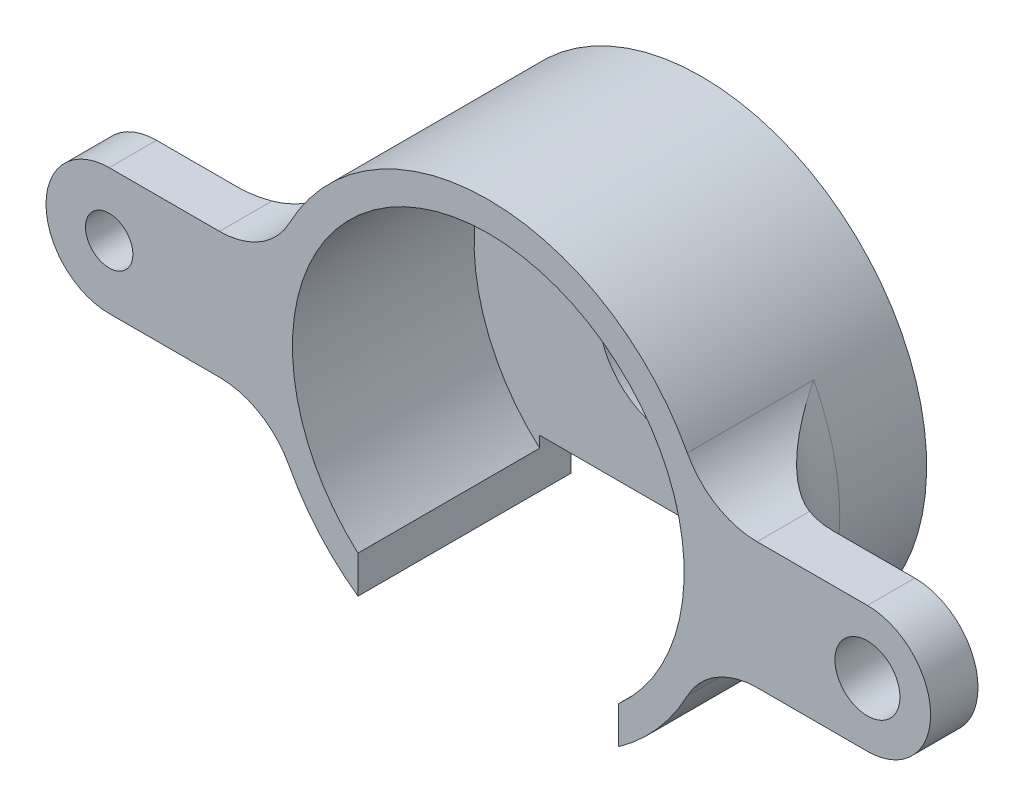
from build123d import *

# Parameters (mm, degrees)
SKETCH_1_R          = 14.25
SKETCH_1_R_2        = 12.4
EXTRUDE_1_DEPTH     = 11.5
EXTRUDE_START       = 2
SKETCH_2_R          = 14.25
SKETCH_2_R_2        = 4.5
SKETCH_2_R_3        = 1.5
EXTRUDE_2_DEPTH     = 2
SKETCH_4_W          = 16.5
SKETCH_4_H          = 7.711801842
CUT_EXTRUDE_2_DEPTH = 19
EXTRUDE_START_2     = -3
SKETCH_5_R          = 1.5
SKETCH_5_R_2        = 2.058377943
EXTRUDE_3_DEPTH     = 3
FILLET_1_R          = 5


with BuildPart() as part:
    # 草图1 → 凸台-拉伸1 (new body)
    with BuildSketch(Plane.XY):
        Circle(SKETCH_1_R)
        Circle(SKETCH_1_R_2, mode=Mode.SUBTRACT)
    extrude(amount=EXTRUDE_1_DEPTH)

    # 草图2 → 凸台-拉伸2 (add)
    with BuildSketch(Plane(origin=(0, 0, 0), x_dir=(-1, 0, 0), z_dir=(0, 0, -1)).offset(EXTRUDE_START)):
        Circle(SKETCH_2_R)
        Circle(SKETCH_2_R_2, mode=Mode.SUBTRACT)
        with Locations((-10, 0)):
            Circle(SKETCH_2_R_3, mode=Mode.SUBTRACT)
    extrude(amount=-EXTRUDE_2_DEPTH)

    # 草图4 → 切除-拉伸2 (cut)
    with BuildSketch(Plane.XY.offset(11.5)):
        with Locations((0, -12.4)):
            Rectangle(SKETCH_4_W, SKETCH_4_H)
    extrude(amount=-CUT_EXTRUDE_2_DEPTH, mode=Mode.SUBTRACT)

    # 草图5 → 凸台-拉伸3 (add)
    # profile 1 of 2: a face of its own
    with BuildSketch(Plane.XY.offset(11.5).offset(EXTRUDE_START_2)):
        with BuildLine():
            Line((-24, 4), (-13.677079367, 4))
            ThreePointArc((-13.677079367, 4), (-14.25, 0), (-13.677079367, -4))
            Line((-13.677079367, -4), (-24, -4))
            ThreePointArc((-24, -4), (-28, 0), (-24, 4))
        make_face()
        with Locations((-24, 0)):
            Circle(SKETCH_5_R, mode=Mode.SUBTRACT)
    # profile 2 of 2: a face of its own
    with BuildSketch(Plane.XY.offset(11.5).offset(EXTRUDE_START_2)):
        with BuildLine():
            Line((13.677079367, 4), (24, 4))
            ThreePointArc((24, 4), (28, 0), (24, -4))
            Line((24, -4), (13.677079367, -4))
            ThreePointArc((13.677079367, -4), (14.25, 0), (13.677079367, 4))
        make_face()
        with Locations((24, 0)):
            Circle(SKETCH_5_R_2, mode=Mode.SUBTRACT)
    extrude(amount=EXTRUDE_3_DEPTH)

    # 圆角1
    fillet_1_edges = [part.edges().sort_by_distance(p)[0] for p in [
        (-13.677079367, 4, 10),
        (-13.677079367, -4, 10),
        (-14.25, 0, 8.5),
        (13.677079367, -4, 10),
        (13.677079367, 4, 10),
        (14.25, 0, 8.5),
    ]]
    fillet(fillet_1_edges, radius=FILLET_1_R)


solid = part.part
